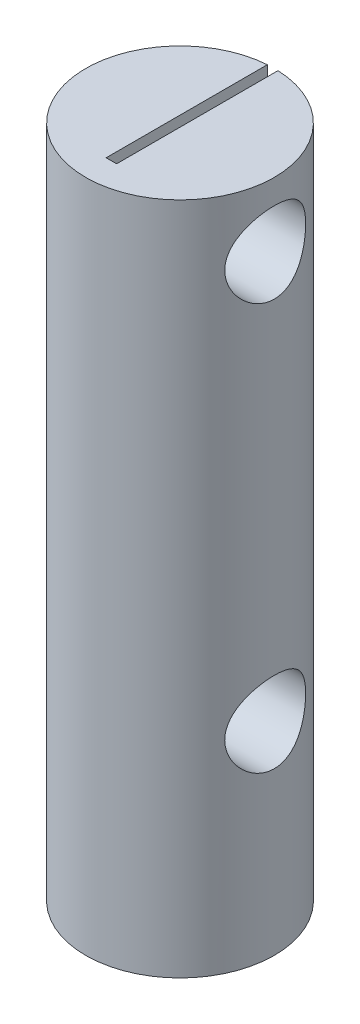
from build123d import *

# Parameters (mm, degrees)
SKETCH1_R               = 7
BOSS_EXTRUDE1_DEPTH     = 50
SKETCH2_W               = 0.776080751
SKETCH2_H               = 12.3835138
CUT_EXTRUDE1_DEPTH      = 100
CUT_EXTRUDE2_DEPTH      = 40
CUT_EXTRUDE2_DEPTH_BACK = 40
SKETCH3_R               = 3


with BuildPart() as part:
    # Sketch1 → Boss-Extrude1 (new body)
    with BuildSketch(Plane(origin=(0, 0, 0), x_dir=(1, 0, 0), z_dir=(0, 1, 0))):
        with Locations(Location((0, 0, 0), (0, 0, 270))):
            Circle(SKETCH1_R)
    extrude(amount=BOSS_EXTRUDE1_DEPTH)

    # Sketch2 → Cut-Extrude1 (cut)
    with BuildSketch(Plane(origin=(0, 50, 0), x_dir=(1, 0, 0), z_dir=(0, 1, 0))):
        with Locations((-0.111959624, 1.211880607)):
            Rectangle(SKETCH2_W, SKETCH2_H)
    extrude(amount=-CUT_EXTRUDE1_DEPTH, mode=Mode.SUBTRACT)

    # Sketch3 → Cut-Extrude2 (cut, two sides: drawn at the far end of the back side and taken through both)
    with BuildSketch(Plane(origin=(0, 0, 0), x_dir=(0, 0, -1), z_dir=(1, 0, 0)).offset(-CUT_EXTRUDE2_DEPTH_BACK)):
        with Locations(Location((-0.002723223, 15, 0), (0, 0, 180))):
            Circle(SKETCH3_R)
        with Locations(Location((-0.002723223, 45.179912014, 0), (0, 0, 180))):
            Circle(SKETCH3_R)
    extrude(amount=CUT_EXTRUDE2_DEPTH + CUT_EXTRUDE2_DEPTH_BACK, mode=Mode.SUBTRACT)


solid = part.part
